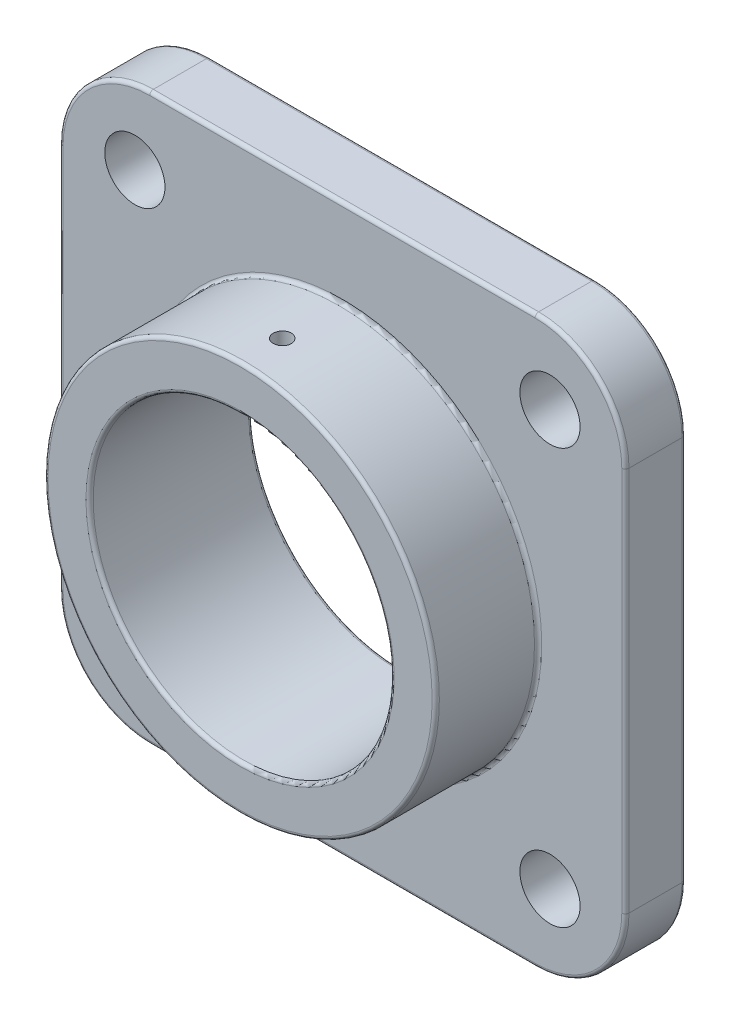
from build123d import *

# Parameters (mm, degrees)
SKETCH1_W           = 94
SKETCH1_H           = 94
SKETCH1_R           = 32.5
BOSS_EXTRUDE1_DEPTH = 10
SKETCH1_3_R         = 32.5
SKETCH1_3_R_2       = 25
BOSS_EXTRUDE2_DEPTH = 27
FILLET1_R           = 15
CUT_EXTRUDE1_REACH  = 121.213
SKETCH3_R           = 1.5
FILLET2_R           = 0.6
CUT_EXTRUDE2_REACH  = 70.608
SKETCH2_R           = 5
CIRPATTERN1_COUNT   = 4


with BuildPart() as part:
    # Sketch1 → Boss-Extrude1 (new body)
    with BuildSketch(Plane.XY):
        Rectangle(SKETCH1_W, SKETCH1_H)
        Circle(SKETCH1_R, mode=Mode.SUBTRACT)
    extrude(amount=BOSS_EXTRUDE1_DEPTH)

    # Sketch1<3> → Boss-Extrude2 (add)
    with BuildSketch(Plane.XY):
        Circle(SKETCH1_3_R)
        Circle(SKETCH1_3_R_2, mode=Mode.SUBTRACT)
    extrude(amount=BOSS_EXTRUDE2_DEPTH)

    # Fillet1
    fillet1_edges = [part.edges().sort_by_distance(p)[0] for p in [
        (-47, -47, 5),
        (47, -47, 5),
        (-47, 47, 5),
        (47, 47, 5),
    ]]
    fillet(fillet1_edges, radius=FILLET1_R)

    # Sketch3 → Cut-Extrude1 (cut, up to next)
    with BuildSketch(Plane(origin=(0, 59.178176016, 0), x_dir=(1, 0, 0), z_dir=(0, 1, 0)), mode=Mode.PRIVATE) as cut_extrude1_sk1:
        with Locations((0, -20)):
            Circle(SKETCH3_R)
    cut_extrude1_tool1 = extrude(cut_extrude1_sk1.sketch, amount=-CUT_EXTRUDE1_REACH, mode=Mode.PRIVATE) & part.part
    add(cut_extrude1_tool1.solids().sort_by_distance((0, 59.178176, 20))[0], mode=Mode.SUBTRACT)

    # Fillet2
    fillet2_edges = [part.edges().sort_by_distance(p)[0] for p in [
        (-25, 0, 0),
        (42.606601718, -42.606601718, 0),
        (47, 0, 0),
        (42.606601718, 42.606601718, 0),
        (0, 47, 0),
        (-42.606601718, 42.606601718, 0),
        (-47, 0, 0),
        (-42.606601718, -42.606601718, 0),
        (0, -47, 0),
        (-42.606601718, 42.606601718, 10),
        (0, 47, 10),
        (42.606601718, 42.606601718, 10),
        (47, 0, 10),
        (42.606601718, -42.606601718, 10),
        (0, -47, 10),
        (-42.606601718, -42.606601718, 10),
        (-47, 0, 10),
        (-32.5, 0, 10),
        (-25, 0, 27),
        (-32.5, 0, 27),
    ]]
    fillet(fillet2_edges, radius=FILLET2_R)

    # Sketch2 → Cut-Extrude2 (cut, up to next)
    with BuildSketch(Plane.XY.offset(10), mode=Mode.PRIVATE) as cut_extrude2_sk1:
        with Locations((34.474873734, 34.474873734)):
            Circle(SKETCH2_R)
    cut_extrude2_tool1 = extrude(cut_extrude2_sk1.sketch, amount=-CUT_EXTRUDE2_REACH, mode=Mode.PRIVATE) & part.part
    cut_extrude2 = cut_extrude2_tool1.solids().sort_by_distance((34.474874, 34.474874, 10))[0]
    add(cut_extrude2, mode=Mode.SUBTRACT)

    # CirPattern1: Cut-Extrude2 ×4 about axis
    cirpattern1_axis = Axis((0, 0, 27), (0, 0, -1))
    for i in range(1, CIRPATTERN1_COUNT):
        add(cut_extrude2.rotate(cirpattern1_axis, i * 360 / CIRPATTERN1_COUNT), mode=Mode.SUBTRACT)


solid = part.part
